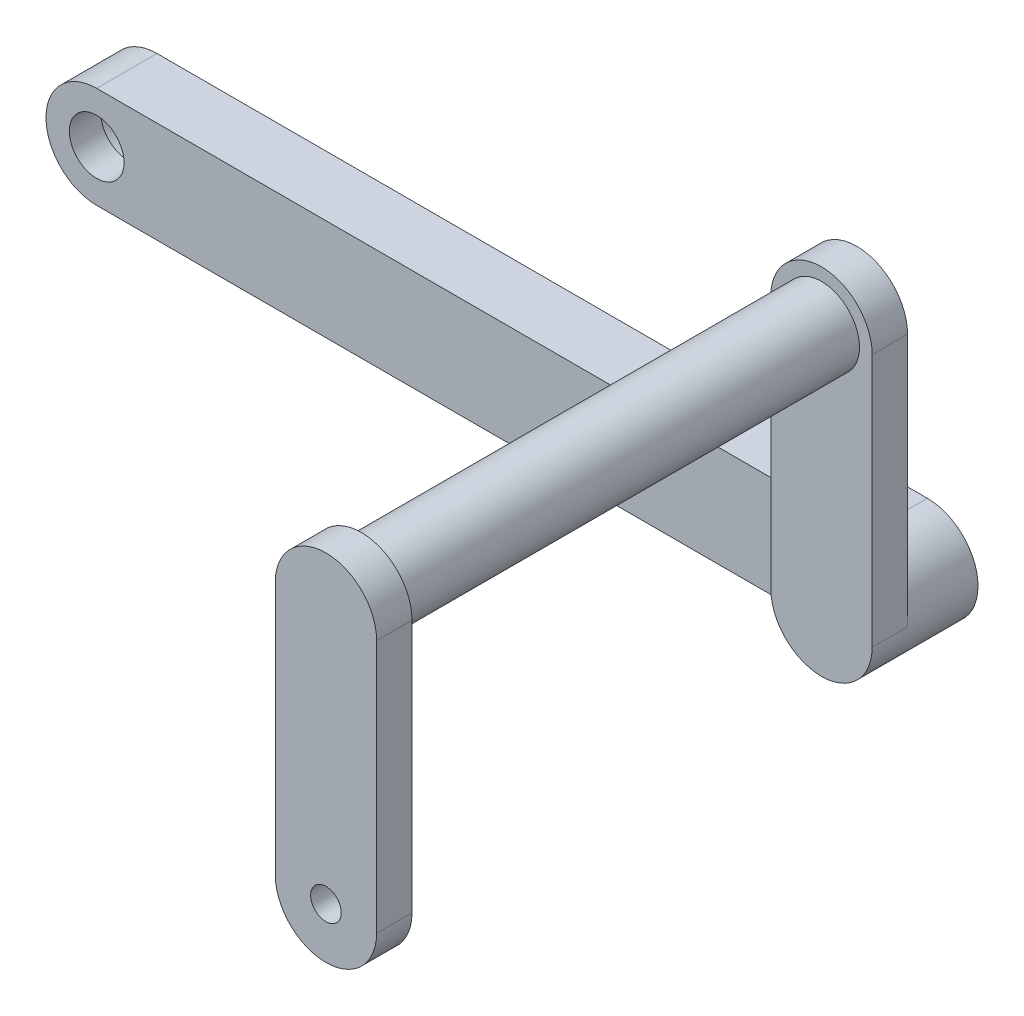
from build123d import *

# Parameters (mm, degrees)
CROQUIS1_R              = 1.7
SALIENTE_EXTRUIR1_DEPTH = 3.75
CROQUIS2_R              = 3.15
SALIENTE_EXTRUIR2_DEPTH = 0.63
SALIENTE_EXTRUIR3_DEPTH = 2.2
CROQUIS4_R              = 2.365
SALIENTE_EXTRUIR4_DEPTH = 28.6
CROQUIS5_R              = 0.95
SALIENTE_EXTRUIR5_DEPTH = 2.2
CROQUIS6_R              = 1.25
CORTAR_EXTRUIR1_DEPTH   = 0.5
CROQUIS7_R              = 2.5
CORTAR_EXTRUIR2_DEPTH   = 1.8


with BuildPart() as part:
    # Croquis1 → Saliente-Extruir1 (new body)
    with BuildSketch(Plane.XY):
        with BuildLine():
            Line((0, 3.15), (47.88, 3.15))
            ThreePointArc((47.88, 3.15), (51.03, 0), (47.88, -3.15))
            Line((47.88, -3.15), (0, -3.15))
            ThreePointArc((0, -3.15), (-3.15, 0), (0, 3.15))
        make_face()
        Circle(CROQUIS1_R, mode=Mode.SUBTRACT)
    extrude(amount=SALIENTE_EXTRUIR1_DEPTH)

    # Croquis2 → Saliente-Extruir2 (add)
    with BuildSketch(Plane.XY.offset(3.75)):
        with Locations(Location((47.88, 0, 0), (0, 0, 90))):
            Circle(CROQUIS2_R)
    extrude(amount=SALIENTE_EXTRUIR2_DEPTH)

    # Croquis3 → Saliente-Extruir3 (add)
    with BuildSketch(Plane.XY.offset(4.38)):
        with BuildLine():
            Line((44.73, 15.75), (44.73, 0))
            ThreePointArc((44.73, 0), (47.88, -3.15), (51.03, 0))
            Line((51.03, 0), (51.03, 15.75))
            ThreePointArc((51.03, 15.75), (47.88, 18.9), (44.73, 15.75))
        make_face()
    extrude(amount=SALIENTE_EXTRUIR3_DEPTH)

    # Croquis4 → Saliente-Extruir4 (add)
    with BuildSketch(Plane.XY.offset(6.58)):
        with Locations((47.88, 15.75)):
            Circle(CROQUIS4_R)
    extrude(amount=SALIENTE_EXTRUIR4_DEPTH)

    # Croquis5 → Saliente-Extruir5 (add)
    with BuildSketch(Plane.XY.offset(35.18)):
        with BuildLine():
            Line((44.73, 15.75), (44.73, 0))
            ThreePointArc((44.73, 0), (47.88, -3.15), (51.03, 0))
            Line((51.03, 0), (51.03, 15.75))
            ThreePointArc((51.03, 15.75), (47.88, 18.9), (44.73, 15.75))
        make_face()
        with Locations((47.88, 0)):
            Circle(CROQUIS5_R, mode=Mode.SUBTRACT)
    extrude(amount=SALIENTE_EXTRUIR5_DEPTH)

    # Croquis6 → Cortar-Extruir1 (cut)
    with BuildSketch(Plane(origin=(0, 0, 35.18), x_dir=(-1, 0, 0), z_dir=(0, 0, -1))):
        with Locations((-47.88, 0)):
            Circle(CROQUIS6_R)
    extrude(amount=-CORTAR_EXTRUIR1_DEPTH, mode=Mode.SUBTRACT)

    # Croquis7 → Cortar-Extruir2 (cut)
    with BuildSketch(Plane(origin=(0, 0, 0), x_dir=(-1, 0, 0), z_dir=(0, 0, -1))):
        Circle(CROQUIS7_R)
    extrude(amount=-CORTAR_EXTRUIR2_DEPTH, mode=Mode.SUBTRACT)


solid = part.part
